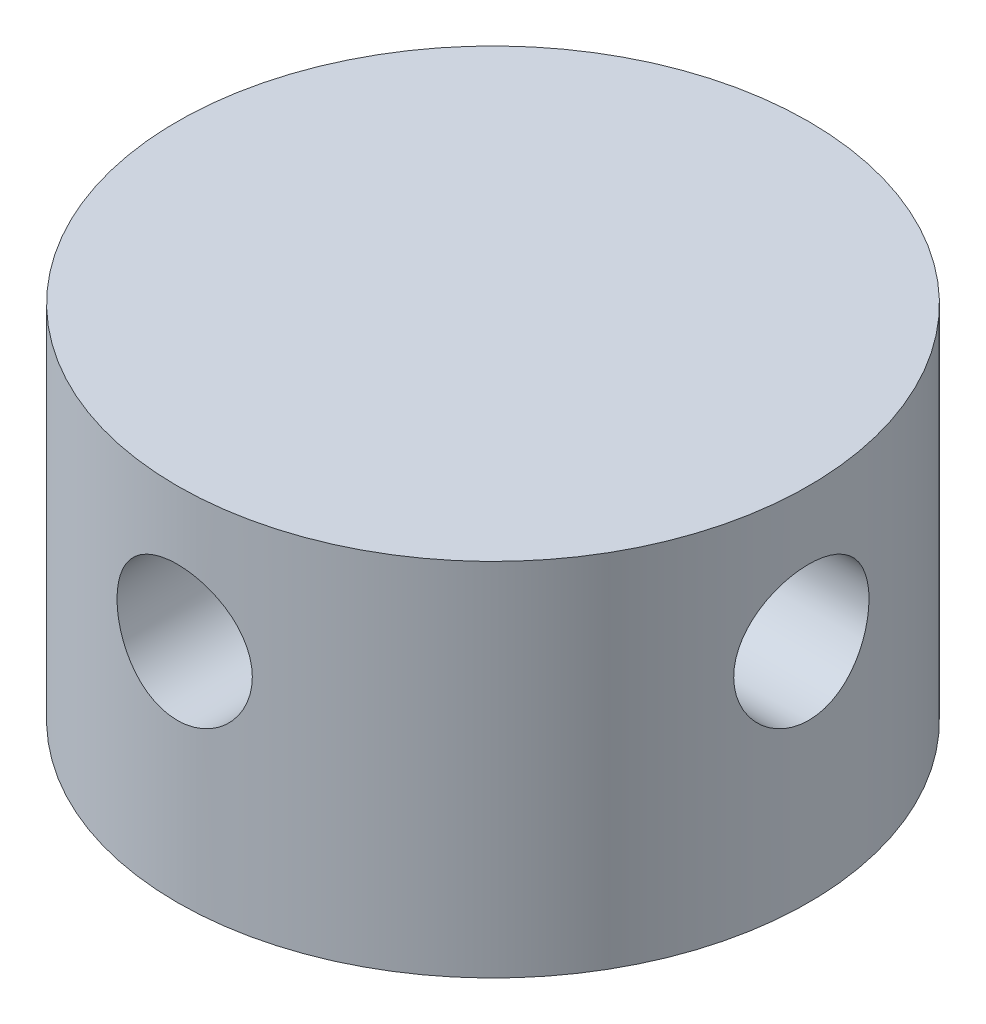
from build123d import *

# Parameters (mm, degrees)
SKETCH1_R           = 14
BOSS_EXTRUDE1_DEPTH = 16
SKETCH2_R           = 3
CUT_EXTRUDE1_DEPTH  = 5
CIRPATTERN1_COUNT   = 4


with BuildPart() as part:
    # Sketch1 → Boss-Extrude1 (new body)
    with BuildSketch(Plane(origin=(0, 0, 0), x_dir=(1, 0, 0), z_dir=(0, 1, 0))):
        Circle(SKETCH1_R)
    extrude(amount=BOSS_EXTRUDE1_DEPTH)

    # Sketch2 → Cut-Extrude1 (cut)
    with BuildSketch(Plane(origin=(14, 0, 0), x_dir=(0, 0, -1), z_dir=(1, 0, 0))):
        with Locations((0, 9.995362646)):
            Circle(SKETCH2_R)
    cut_extrude1 = extrude(amount=-CUT_EXTRUDE1_DEPTH, mode=Mode.SUBTRACT)

    # CirPattern1: Cut-Extrude1 ×4 about axis
    cirpattern1_axis = Axis((0, 16, 0), (0, -1, 0))
    for i in range(1, CIRPATTERN1_COUNT):
        add(cut_extrude1.rotate(cirpattern1_axis, i * 360 / CIRPATTERN1_COUNT), mode=Mode.SUBTRACT)


solid = part.part
